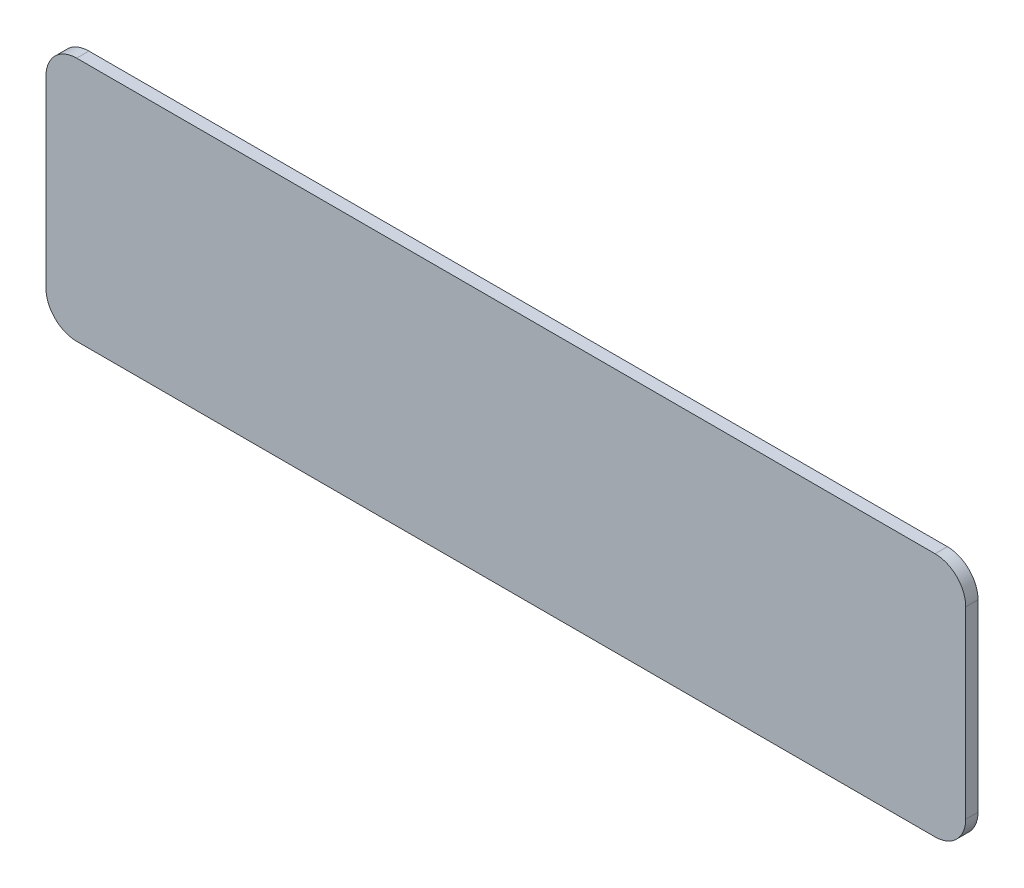
from build123d import *

# Parameters (mm, degrees)
BOSS_EXTRUDE1_DEPTH = 1


with BuildPart() as part:
    # Sketch1 → Boss-Extrude1 (new, symmetric)
    with BuildSketch(Plane.XY):
        with BuildLine():
            Line((-4.498723713, -19.116500582), (15.501276287, -19.116500582))
            Line((15.501276287, -19.116500582), (75.501276287, -19.116500582))
            ThreePointArc((75.501276287, -19.116500582), (79.036810193, -17.652034487), (80.501276287, -14.116500582))
            Line((80.501276287, -14.116500582), (80.501276287, 15.883499418))
            ThreePointArc((80.501276287, 15.883499418), (79.036810193, 19.419033324), (75.501276287, 20.883499418))
            Line((75.501276287, 20.883499418), (-64.498723713, 20.883499418))
            ThreePointArc((-64.498723713, 20.883499418), (-68.034257619, 19.419033324), (-69.498723713, 15.883499418))
            Line((-69.498723713, 15.883499418), (-69.498723713, -14.116500582))
            ThreePointArc((-69.498723713, -14.116500582), (-68.034257619, -17.652034487), (-64.498723713, -19.116500582))
            Line((-64.498723713, -19.116500582), (-4.498723713, -19.116500582))
        make_face()
    extrude(amount=BOSS_EXTRUDE1_DEPTH, both=True)


solid = part.part
